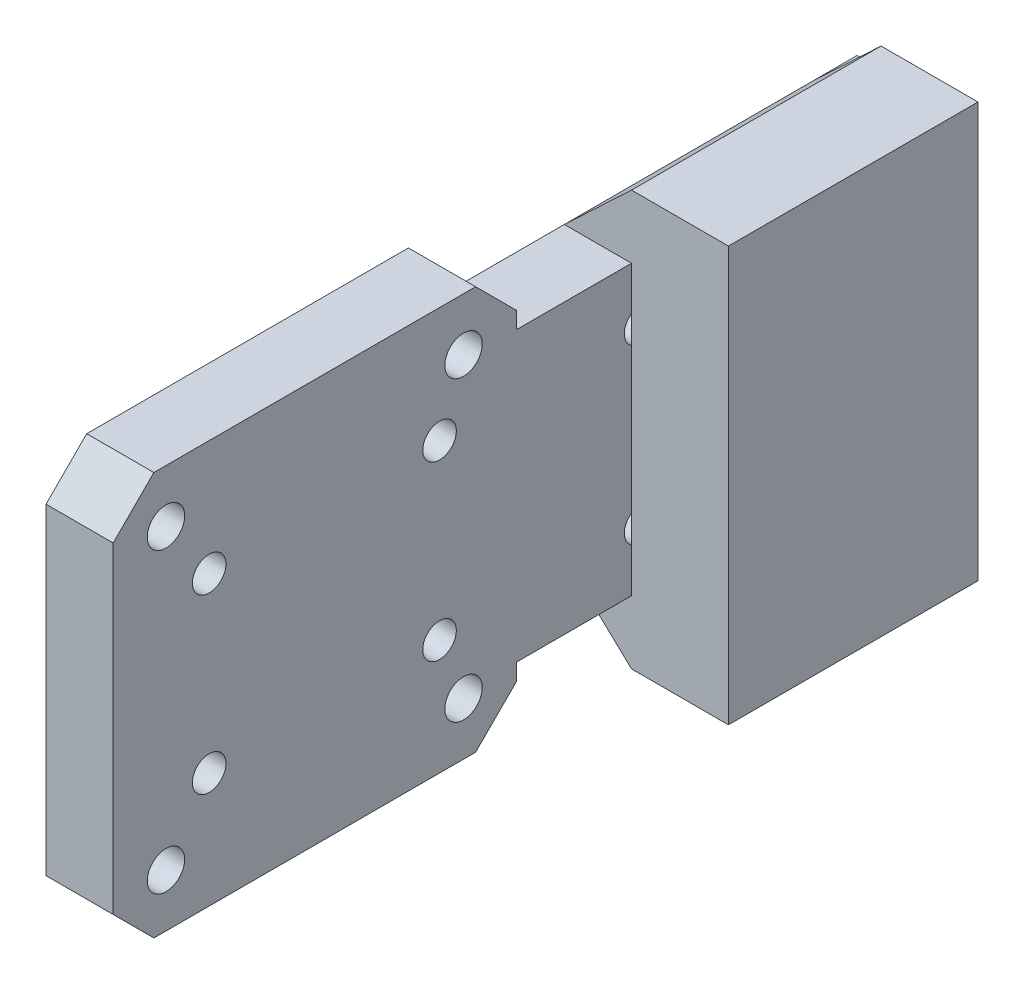
from build123d import *

# Parameters (mm, degrees)
SKETCH2_W                                    = 26
SKETCH2_H                                    = 43.2
BOSS_EXTRUDE1_DEPTH                          = 10.1
SKETCH3_R                                    = 1.75
BOSS_EXTRUDE2_DEPTH                          = 7
BOSS_EXTRUDE3_DEPTH                          = 26
BOSS_EXTRUDE4_DEPTH                          = 7
CHAMFER1_SIZE                                = 4.24
CBORE_FOR_M5_HEX_HEAD_CAP_SCREW1_D           = 3.9
CBORE_FOR_M5_HEX_HEAD_CAP_SCREW1_CBORE_D     = 6
CBORE_FOR_M5_HEX_HEAD_CAP_SCREW1_CBORE_DEPTH = 4


with BuildPart() as part:
    # Sketch2 → Boss-Extrude1 (new body)
    with BuildSketch(Plane(origin=(0, 0, 0), x_dir=(0, 0, -1), z_dir=(1, 0, 0))):
        Rectangle(SKETCH2_W, SKETCH2_H)
    extrude(amount=BOSS_EXTRUDE1_DEPTH)

    # Sketch3 → Boss-Extrude2 (add)
    with BuildSketch(Plane.ZY):
        Polygon((-17.5, 15), (17.5, 15), (62.5, 15), (62.5, -15), (17.5, -15), (-17.5, -15), align=None)
        with Locations(Location((12, 9, 0), (0, 0, 304.849904579))):
            Circle(SKETCH3_R, mode=Mode.SUBTRACT)
        with Locations(Location((12, -9, 0), (0, 0, 55.150095421))):
            Circle(SKETCH3_R, mode=Mode.SUBTRACT)
        with Locations(Location((-12, -9, 0), (0, 0, 124.849904579))):
            Circle(SKETCH3_R, mode=Mode.SUBTRACT)
        with Locations(Location((-12, 9, 0), (0, 0, 124.849904579))):
            Circle(SKETCH3_R, mode=Mode.SUBTRACT)
        with Locations(Location((57, -9, 0), (0, 0, 180))):
            Circle(SKETCH3_R, mode=Mode.SUBTRACT)
        with Locations(Location((57, 9, 0), (0, 0, 180))):
            Circle(SKETCH3_R, mode=Mode.SUBTRACT)
        with Locations(Location((33, -9, 0), (0, 0, 180))):
            Circle(SKETCH3_R, mode=Mode.SUBTRACT)
        with Locations(Location((33, 9, 0), (0, 0, 180))):
            Circle(SKETCH3_R, mode=Mode.SUBTRACT)
    extrude(amount=BOSS_EXTRUDE2_DEPTH)

    # Sketch5 → Boss-Extrude3 (add)
    with BuildSketch(Plane(origin=(0, 0, -13), x_dir=(-1, 0, 0), z_dir=(0, 0, -1))):
        Polygon((0, -21.6), (0, -15), (7, -15), align=None)
        Polygon((7, 15), (0, 15), (0, 21.6), align=None)
    extrude(amount=-BOSS_EXTRUDE3_DEPTH)

    # Sketch7 → Boss-Extrude4 (add)
    with BuildSketch(Plane.ZY.offset(7)):
        Polygon((67, -21), (67, 21), (25, 21), (25, 15), (62.5, 15), (62.5, -15), (25, -15), (25, -21), align=None)
    extrude(amount=-BOSS_EXTRUDE4_DEPTH)

    # Chamfer1
    chamfer1_edges = [part.edges().sort_by_distance(p)[0] for p in [
        (-3.5, -21, 25),
        (-3.5, -21, 67),
        (-3.5, 21, 67),
        (-3.5, 21, 25),
    ]]
    chamfer(chamfer1_edges, length=CHAMFER1_SIZE)

    # CBORE for M5 Hex Head Cap Screw1 (through all)
    with Locations(Plane.ZY.offset(7)):
        with Locations((61.5, 15.5), (61.5, -15.5), (30.5, -15.5), (30.5, 15.5)):
            CounterBoreHole(CBORE_FOR_M5_HEX_HEAD_CAP_SCREW1_D / 2, CBORE_FOR_M5_HEX_HEAD_CAP_SCREW1_CBORE_D / 2, CBORE_FOR_M5_HEX_HEAD_CAP_SCREW1_CBORE_DEPTH)


solid = part.part
